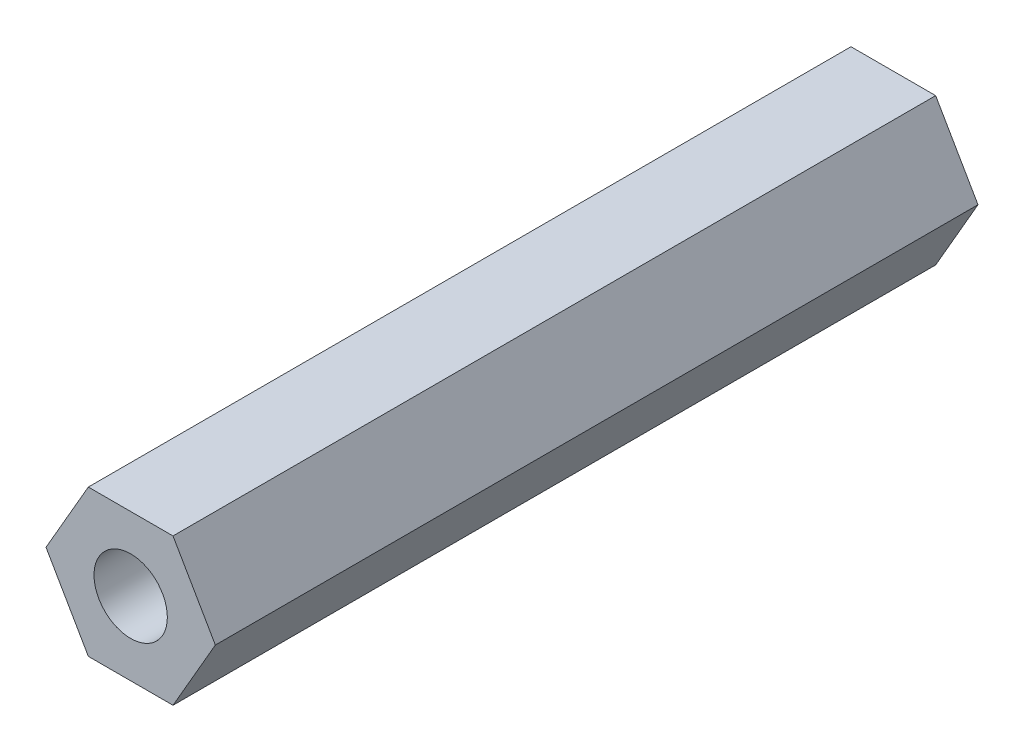
from build123d import *

# Parameters (mm, degrees)
SKETCH1_R           = 3.175
BOSS_EXTRUDE1_DEPTH = 66.04


with BuildPart() as part:
    # Sketch1 → Boss-Extrude1 (new body)
    with BuildSketch(Plane.XY):
        Polygon((7.332348419, 0), (3.666174209, 6.35), (-3.666174209, 6.35), (-7.332348419, 0), (-3.666174209, -6.35), (3.666174209, -6.35), align=None)
        Circle(SKETCH1_R, mode=Mode.SUBTRACT)
    extrude(amount=BOSS_EXTRUDE1_DEPTH)


solid = part.part
